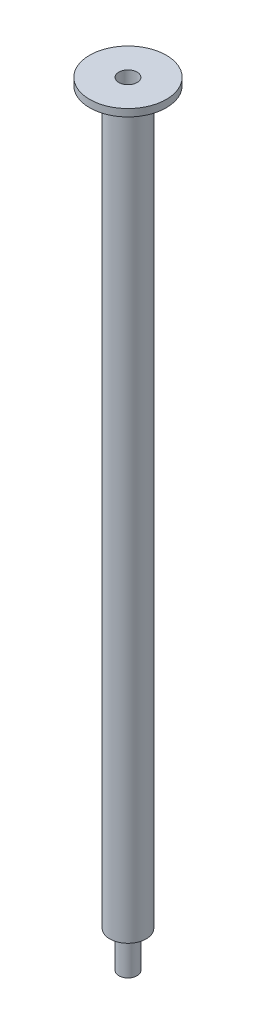
from build123d import *

# Parameters (mm, degrees)
SKETCH2_R           = 5
BOSS_EXTRUDE1_DEPTH = 200
SKETCH3_R           = 10.5
BOSS_EXTRUDE2_DEPTH = 2
SKETCH4_R           = 2.5
CUT_EXTRUDE1_DEPTH  = 10
SKETCH5_R           = 2.5
BOSS_EXTRUDE3_DEPTH = 10


with BuildPart() as part:
    # Sketch2 → Boss-Extrude1 (new body)
    with BuildSketch(Plane(origin=(0, 0, 0), x_dir=(1, 0, 0), z_dir=(0, 1, 0))):
        with Locations(Location((0, 0, 0), (0, 0, 270))):
            Circle(SKETCH2_R)
    extrude(amount=BOSS_EXTRUDE1_DEPTH)

    # Sketch3 → Boss-Extrude2 (add)
    with BuildSketch(Plane(origin=(0, 200, 0), x_dir=(1, 0, 0), z_dir=(0, 1, 0))):
        with Locations(Location((0, 0, 0), (0, 0, 270))):
            Circle(SKETCH3_R)
    extrude(amount=BOSS_EXTRUDE2_DEPTH)

    # Sketch4 → Cut-Extrude1 (cut)
    with BuildSketch(Plane(origin=(0, 202, 0), x_dir=(1, 0, 0), z_dir=(0, 1, 0))):
        with Locations(Location((0, 0, 0), (0, 0, 270))):
            Circle(SKETCH4_R)
    extrude(amount=-CUT_EXTRUDE1_DEPTH, mode=Mode.SUBTRACT)

    # Sketch5 → Boss-Extrude3 (add)
    with BuildSketch(Plane.XZ):
        with Locations(Location((0, 0, 0), (0, 0, 90))):
            Circle(SKETCH5_R)
    extrude(amount=BOSS_EXTRUDE3_DEPTH)


solid = part.part
